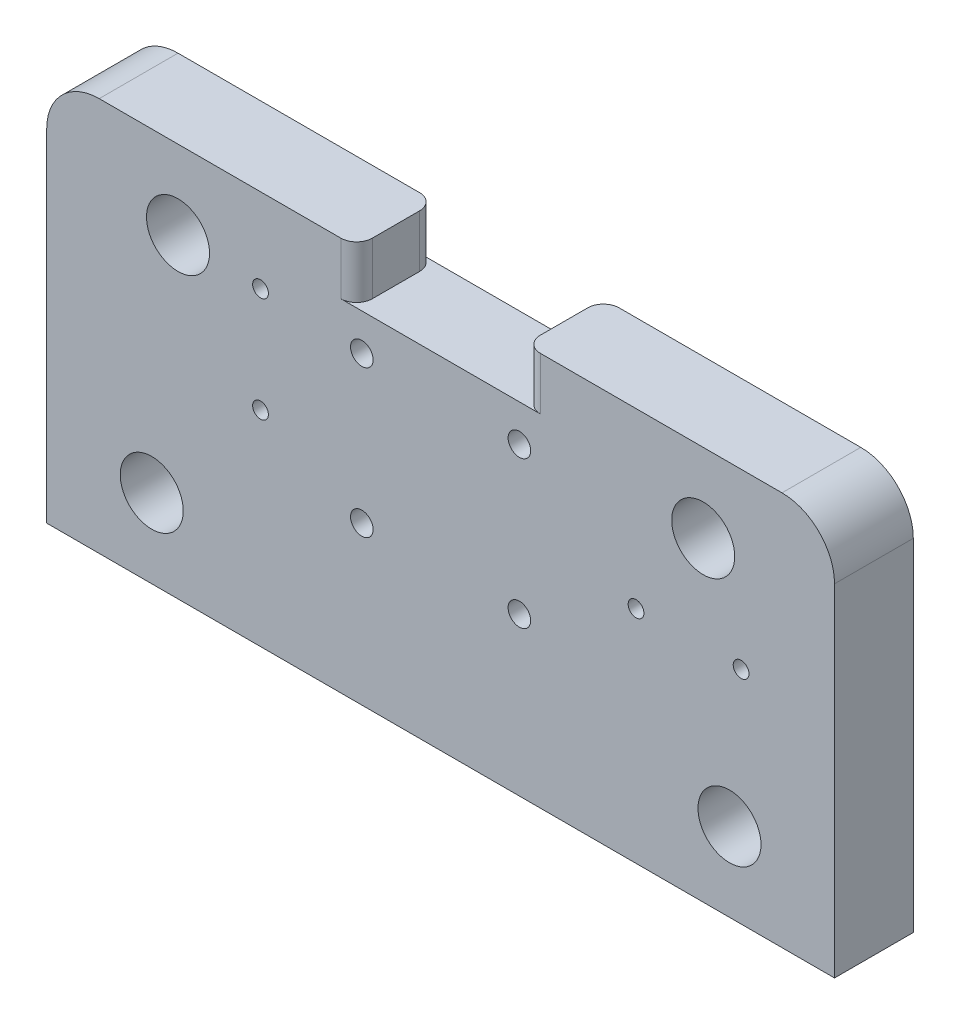
from build123d import *

# Parameters (mm, degrees)
SKETCH_1_R          = 2.15
EXTRUDE_1_DEPTH     = 15
SKETCH_2_R          = 6
CUT_EXTRUDE_1_DEPTH = 86.183625187
FILLET_1_R          = 3
SKETCH_3_R          = 1.5
CUT_EXTRUDE_2_DEPTH = 86.183625187
SKETCH_4_R          = 1.5
CUT_EXTRUDE_3_DEPTH = 86.183625187


with BuildPart() as part:
    # 草图1 → 凸台-拉伸1 (new body)
    with BuildSketch(Plane.XY):
        with BuildLine():
            Line((16, 37.5), (65, 37.5))
            ThreePointArc((65, 37.5), (72.071067812, 34.571067812), (75, 27.5))
            Line((75, 27.5), (75, -37.5))
            Line((75, -37.5), (-75, -37.5))
            Line((-75, -37.5), (-75, 27.5))
            ThreePointArc((-75, 27.5), (-72.071067812, 34.571067812), (-65, 37.5))
            Line((-65, 37.5), (-16, 37.5))
            Line((-16, 37.5), (-16, 27.5))
            Line((-16, 27.5), (16, 27.5))
            Line((16, 27.5), (16, 37.5))
        make_face()
        with Locations((-15, 20.5)):
            Circle(SKETCH_1_R, mode=Mode.SUBTRACT)
        with Locations((15, 20.5)):
            Circle(SKETCH_1_R, mode=Mode.SUBTRACT)
        with Locations((-15, -7.5)):
            Circle(SKETCH_1_R, mode=Mode.SUBTRACT)
        with Locations((15, -7.5)):
            Circle(SKETCH_1_R, mode=Mode.SUBTRACT)
    extrude(amount=EXTRUDE_1_DEPTH)

    # 草图2 → 切除-拉伸1 (cut, through all)
    with BuildSketch(Plane.XY.offset(15)):
        with Locations((-50, 22.5)):
            Circle(SKETCH_2_R)
        with Locations((50, 22.5)):
            Circle(SKETCH_2_R)
        with Locations((-55, -22.5)):
            Circle(SKETCH_2_R)
        with Locations((55, -22.5)):
            Circle(SKETCH_2_R)
    extrude(amount=-CUT_EXTRUDE_1_DEPTH, mode=Mode.SUBTRACT)

    # 圆角1
    fillet_1_edges = [part.edges().sort_by_distance(p)[0] for p in [
        (-16, 32.5, 15),
        (16, 32.5, 0),
        (-16, 32.5, 0),
        (16, 32.5, 15),
    ]]
    fillet(fillet_1_edges, radius=FILLET_1_R)

    # 草图3 → 切除-拉伸2 (cut, through all)
    with BuildSketch(Plane.XY.offset(15)):
        with Locations((-34.29, 1.5)):
            Circle(SKETCH_3_R)
        with Locations((-34.29, 21.5)):
            Circle(SKETCH_3_R)
    extrude(amount=-CUT_EXTRUDE_2_DEPTH, mode=Mode.SUBTRACT)

    # 草图4 → 切除-拉伸3 (cut, through all)
    with BuildSketch(Plane.XY.offset(15)):
        with Locations((57.21, 4.5)):
            Circle(SKETCH_4_R)
        with Locations((37.21, 4.5)):
            Circle(SKETCH_4_R)
    extrude(amount=-CUT_EXTRUDE_3_DEPTH, mode=Mode.SUBTRACT)


solid = part.part
